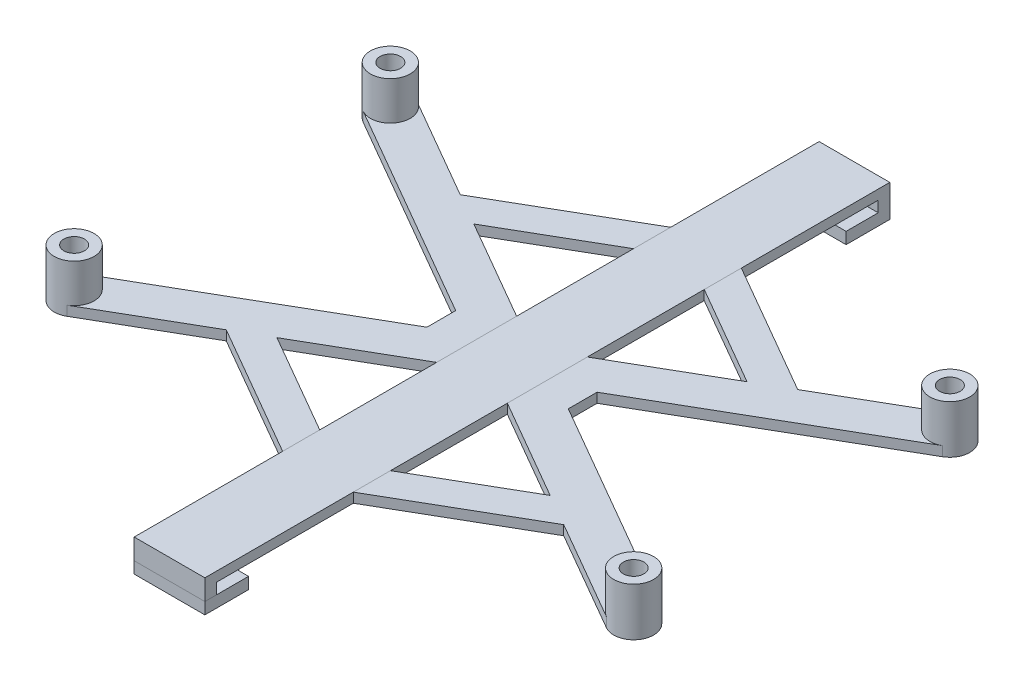
from build123d import *
from build123d.topology import SkipClean

# Parameters (mm, degrees)
EXTRUDE_1_DEPTH   = 1.8
EXTRUDE_1_2_DEPTH = 1.8
SKETCH_2_W        = 11
SKETCH_2_H        = 1.8
EXTRUDE_2_DEPTH   = 1.7
SKETCH_3_W        = 11
SKETCH_3_H        = 106.6
EXTRUDE_3_DEPTH   = 1.5
SKETCH_4_R        = 1.6
EXTRUDE_5_DEPTH   = 1.5
EXTRUDE_5_2_DEPTH = 1.5
SKETCH_5_R        = 3.1
SKETCH_5_R_2      = 1.6
EXTRUDE_6_DEPTH   = 6


with BuildPart() as part:
    # 草图1 → 凸台-拉伸1 (new body)
    with BuildSketch(Plane(origin=(0, 0, 0), x_dir=(1, 0, 0), z_dir=(0, 1, 0))):
        Polygon((5.5, 53.3), (5.5, 51.5), (5.5, 46.5), (-5.5, 46.5), (-5.5, 51.5), (-5.5, 53.3), align=None)
    extrude(amount=-EXTRUDE_1_DEPTH)

    # 草图2 → 凸台-拉伸2 (add)
    with BuildSketch(Plane(origin=(0, 0, 0), x_dir=(1, 0, 0), z_dir=(0, 1, 0))):
        with Locations((0, 52.4)):
            Rectangle(SKETCH_2_W, SKETCH_2_H)
        with Locations((0, -52.4)):
            Rectangle(SKETCH_2_W, SKETCH_2_H)
    extrude(amount=EXTRUDE_2_DEPTH)


with BuildPart() as body_2:
    # 草图1 → Extrude 1 2 (new body)
    with BuildSketch(Plane(origin=(0, 0, 0), x_dir=(1, 0, 0), z_dir=(0, 1, 0))):
        Polygon((-5.5, -51.5), (-5.5, -46.5), (5.5, -46.5), (5.5, -51.5), (5.5, -53.3), (-5.5, -53.3), align=None)
    extrude(amount=-EXTRUDE_1_2_DEPTH)


with BuildPart() as extrude_2_piece_1:
    # of the separate pieces the step leaves, piece 1, a body of its own (extrude_2_pieces)
    add(part.part.solids().sort_by_distance((5.5, -1.8, -53.3))[0])



with BuildPart() as extrude_2_piece_2:
    # of the separate pieces the step leaves, piece 2, a body of its own (extrude_2_pieces)
    add(part.part.solids().sort_by_distance((-5.5, 0, 51.5))[0])


with BuildPart() as extrude_2_piece_1_1:
    add(extrude_2_piece_1.part)

    add(extrude_2_piece_2.part)  # 凸台-拉伸3 merges 凸台-拉伸2 piece 2
    # 草图3 → 凸台-拉伸3 (add)
    with BuildSketch(Plane(origin=(0, 1.7, 0), x_dir=(1, 0, 0), z_dir=(0, 1, 0))):
        Rectangle(SKETCH_3_W, SKETCH_3_H)
    extrude(amount=EXTRUDE_3_DEPTH)


with BuildPart() as body_3:
    # 草图4 → 凸台-拉伸5 (new body)
    with BuildSketch(Plane(origin=(0, 3.2, 0), x_dir=(1, 0, 0), z_dir=(0, 1, 0))):
        with BuildLine():
            ThreePointArc((-41.99, 27.289678752), (-46.224678752, 26.155), (-45.09, 21.920321248))
            Line((-45.09, 21.920321248), (-11, 2.238450572))
            Line((-11, 2.238450572), (-11, -2.238450572))
            Line((-11, -2.238450572), (-45.09, -21.920321248))
            ThreePointArc((-45.09, -21.920321248), (-46.224678752, -26.155), (-41.99, -27.289678752))
            Line((-41.99, -27.289678752), (-26.261662349, -18.208918775))
            Line((-26.261662349, -18.208918775), (-5.5, -30.195670121))
            Line((-5.5, -30.195670121), (-5.5, -24.422167429))
            Line((-5.5, -24.422167429), (-21.261662349, -15.322167429))
            Line((-21.261662349, -15.322167429), (-5.5, -6.222167429))
            Line((-5.5, -6.222167429), (-5.5, 6.222167429))
            Line((-5.5, 6.222167429), (-21.261662349, 15.322167429))
            Line((-21.261662349, 15.322167429), (-5.5, 24.422167429))
            Line((-5.5, 24.422167429), (-5.5, 30.195670121))
            Line((-5.5, 30.195670121), (-26.261662349, 18.208918775))
            Line((-26.261662349, 18.208918775), (-41.99, 27.289678752))
        make_face()
        with Locations(Location((-43.54, 24.605, 0), (0, 0, 270))):
            Circle(SKETCH_4_R, mode=Mode.SUBTRACT)
        with Locations(Location((-43.54, -24.605, 0), (0, 0, 270))):
            Circle(SKETCH_4_R, mode=Mode.SUBTRACT)
    extrude(amount=-EXTRUDE_5_DEPTH)



with BuildPart() as body_4:
    # 草图4 → Extrude 5 2 (new body)
    with BuildSketch(Plane(origin=(0, 3.2, 0), x_dir=(1, 0, 0), z_dir=(0, 1, 0))):
        with BuildLine():
            Line((26.261662349, 18.208918775), (5.5, 30.195670121))
            Line((5.5, 30.195670121), (5.5, 24.422167429))
            Line((5.5, 24.422167429), (21.261662349, 15.322167429))
            Line((21.261662349, 15.322167429), (5.5, 6.222167429))
            Line((5.5, 6.222167429), (5.5, -6.222167429))
            Line((5.5, -6.222167429), (21.261662349, -15.322167429))
            Line((21.261662349, -15.322167429), (5.5, -24.422167429))
            Line((5.5, -24.422167429), (5.5, -30.195670121))
            Line((5.5, -30.195670121), (26.261662349, -18.208918775))
            Line((26.261662349, -18.208918775), (41.99, -27.289678752))
            ThreePointArc((41.99, -27.289678752), (46.224678752, -26.155), (45.09, -21.920321248))
            Line((45.09, -21.920321248), (11, -2.238450572))
            Line((11, -2.238450572), (11, 2.238450572))
            Line((11, 2.238450572), (45.09, 21.920321248))
            ThreePointArc((45.09, 21.920321248), (46.224678752, 26.155), (41.99, 27.289678752))
            Line((41.99, 27.289678752), (26.261662349, 18.208918775))
        make_face()
        with Locations(Location((43.54, 24.605, 0), (0, 0, 270))):
            Circle(SKETCH_4_R, mode=Mode.SUBTRACT)
        with Locations(Location((43.54, -24.605, 0), (0, 0, 270))):
            Circle(SKETCH_4_R, mode=Mode.SUBTRACT)
    extrude(amount=-EXTRUDE_5_2_DEPTH)


with BuildPart() as body_3_1:
    with SkipClean():  # the faces are left unmerged after this step: merging them gives an invalid solid
        add(body_3.part)

        add(body_4.part)  # 凸台-拉伸6 merges body 4
        # 草图5 → 凸台-拉伸6 (add)
        # profile 1 of 4: a face of its own
        with BuildSketch(Plane(origin=(0, 3.2, 0), x_dir=(1, 0, 0), z_dir=(0, 1, 0))):
            with Locations(Location((43.54, 24.605, 0), (0, 0, 270))):
                Circle(SKETCH_5_R)
            with Locations(Location((43.54, 24.605, 0), (0, 0, 270))):
                Circle(SKETCH_5_R_2, mode=Mode.SUBTRACT)
        # profile 2 of 4: a face of its own
        with BuildSketch(Plane(origin=(0, 3.2, 0), x_dir=(1, 0, 0), z_dir=(0, 1, 0))):
            with Locations(Location((43.54, -24.605, 0), (0, 0, 240))):
                Circle(SKETCH_5_R)
            with Locations(Location((43.54, -24.605, 0), (0, 0, 270))):
                Circle(SKETCH_5_R_2, mode=Mode.SUBTRACT)
        # profile 3 of 4: a face of its own
        with BuildSketch(Plane(origin=(0, 3.2, 0), x_dir=(1, 0, 0), z_dir=(0, 1, 0))):
            with Locations(Location((-43.54, -24.605, 0), (0, 0, 270))):
                Circle(SKETCH_5_R)
            with Locations(Location((-43.54, -24.605, 0), (0, 0, 270))):
                Circle(SKETCH_5_R_2, mode=Mode.SUBTRACT)
        # profile 4 of 4: a face of its own
        with BuildSketch(Plane(origin=(0, 3.2, 0), x_dir=(1, 0, 0), z_dir=(0, 1, 0))):
            with Locations(Location((-43.54, 24.605, 0), (0, 0, 240))):
                Circle(SKETCH_5_R)
            with Locations(Location((-43.54, 24.605, 0), (0, 0, 270))):
                Circle(SKETCH_5_R_2, mode=Mode.SUBTRACT)
        extrude(amount=EXTRUDE_6_DEPTH)


solid = Compound([body_2.part, extrude_2_piece_1_1.part, body_3_1.part])
